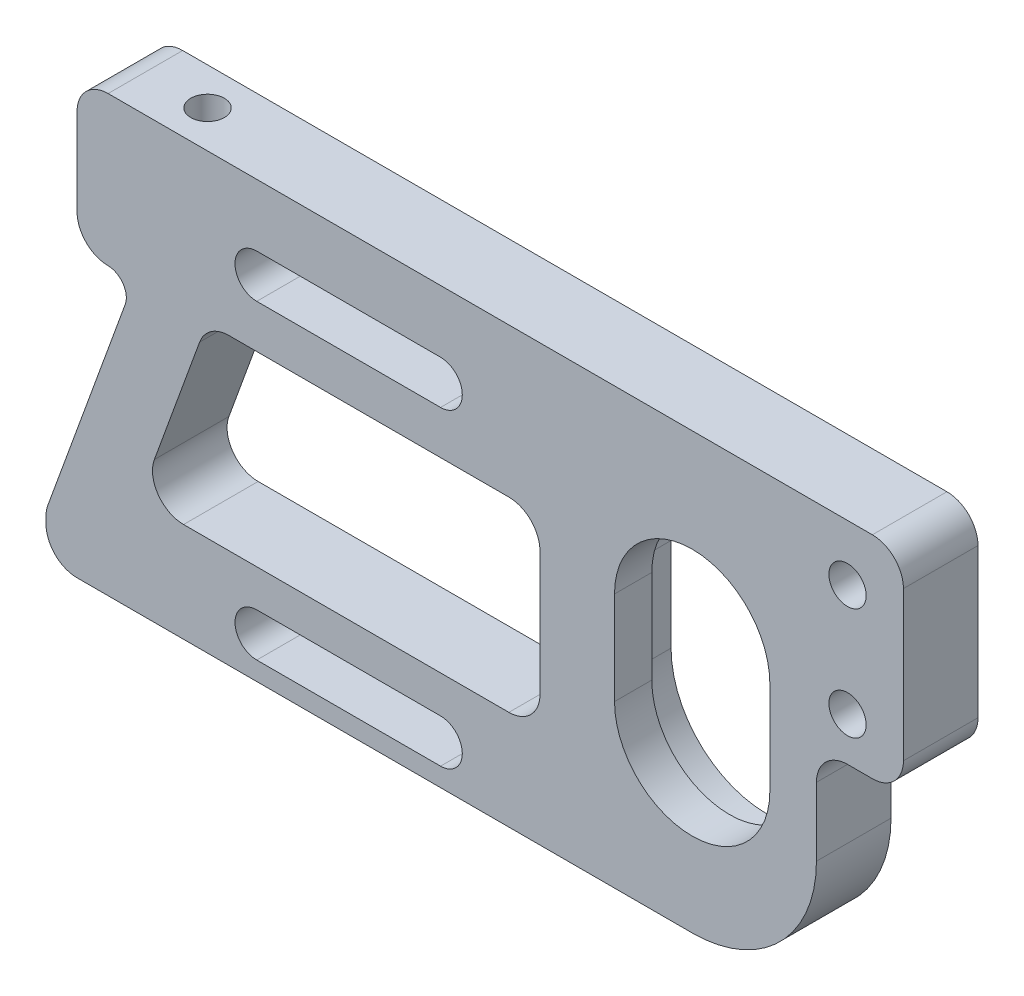
from build123d import *

# Parameters (mm, degrees)
SKETCH1_R           = 1.5
BOSS_EXTRUDE1_DEPTH = 6
SKETCH2_R           = 3.25
CUT_EXTRUDE1_DEPTH  = 3
FILLET1_R           = 2.5
FILLET2_R           = 1.5
FILLET3_R           = 10
CUT_EXTRUDE2_DEPTH  = 2
SKETCH4_R           = 1.35
CUT_EXTRUDE3_DEPTH  = 7
CUT_EXTRUDE4_START  = -10
SKETCH5_R           = 1.35
CUT_EXTRUDE4_DEPTH  = 10


with BuildPart() as part:
    # Sketch1 → Boss-Extrude1 (new body)
    with BuildSketch(Plane.XY):
        Polygon((2.5, 35), (69, 35), (69, 18), (62, 18), (62, 0), (0, 0), (0, 3.474843555), (7.106575765, 23), (2.5, 23), align=None)
        with Locations((64.5, 30.5)):
            Circle(SKETCH1_R, mode=Mode.SUBTRACT)
        with Locations((64.5, 21.5)):
            Circle(SKETCH1_R, mode=Mode.SUBTRACT)
        with BuildLine():
            Line((58.25, 20.5), (58.25, 13))
            ThreePointArc((58.25, 13), (52, 6.75), (45.75, 13))
            Line((45.75, 13), (45.75, 20.5))
            ThreePointArc((45.75, 20.5), (52, 26.75), (58.25, 20.5))
        make_face(mode=Mode.SUBTRACT)
        Polygon((7.5, 8), (39.75, 8), (39.75, 23), (12.959553514, 23), align=None, mode=Mode.SUBTRACT)
        with BuildLine():
            Line((16.959553514, 30), (31.75, 30))
            ThreePointArc((31.75, 30), (33.5, 28.25), (31.75, 26.5))
            Line((31.75, 26.5), (16.959553514, 26.5))
            ThreePointArc((16.959553514, 26.5), (15.209553514, 28.25), (16.959553514, 30))
        make_face(mode=Mode.SUBTRACT)
        with BuildLine():
            Line((16.959553514, 1.5), (31.75, 1.5))
            ThreePointArc((31.75, 1.5), (33.5, 3.25), (31.75, 5))
            Line((31.75, 5), (16.959553514, 5))
            ThreePointArc((16.959553514, 5), (15.209553514, 3.25), (16.959553514, 1.5))
        make_face(mode=Mode.SUBTRACT)
    extrude(amount=BOSS_EXTRUDE1_DEPTH)

    # Sketch2 → Cut-Extrude1 (cut)
    with BuildSketch(Plane(origin=(0, 0, 0), x_dir=(-1, 0, 0), z_dir=(0, 0, -1))):
        with Locations((-64.5, 30.5)):
            Circle(SKETCH2_R)
        with Locations((-64.5, 21.5)):
            Circle(SKETCH2_R)
        with BuildLine():
            Line((-44.3, 20.5), (-44.3, 13))
            ThreePointArc((-44.3, 13), (-52, 5.3), (-59.7, 13))
            Line((-59.7, 13), (-59.7, 20.5))
            ThreePointArc((-59.7, 20.5), (-52, 28.2), (-44.3, 20.5))
        make_face()
    extrude(amount=-CUT_EXTRUDE1_DEPTH, mode=Mode.SUBTRACT)

    # Fillet1
    fillet1_edges = [part.edges().sort_by_distance(p)[0] for p in [
        (0, 0, 3),
        (0, 3.474843555, 3),
        (2.5, 23, 3),
        (2.5, 35, 3),
        (69, 35, 3),
        (69, 18, 3),
        (62, 18, 3),
        (12.959553514, 23, 3),
        (7.5, 8, 3),
        (39.75, 8, 3),
        (39.75, 23, 3),
    ]]
    fillet(fillet1_edges, radius=FILLET1_R)

    # Fillet2
    fillet2_edges = [part.edges().sort_by_distance(p)[0] for p in [
        (7.106575765, 23, 3),
    ]]
    fillet(fillet2_edges, radius=FILLET2_R)

    # Fillet3
    fillet3_edges = [part.edges().sort_by_distance(p)[0] for p in [
        (62, 0, 3),
    ]]
    fillet(fillet3_edges, radius=FILLET3_R)

    # Sketch3 → Cut-Extrude2 (cut)
    with BuildSketch(Plane(origin=(0, 0, 0), x_dir=(-1, 0, 0), z_dir=(0, 0, -1))):
        with BuildLine():
            Line((-31.75, 31.75), (-16.959553514, 31.75))
            ThreePointArc((-16.959553514, 31.75), (-13.459553514, 28.25), (-16.959553514, 24.75))
            Line((-16.959553514, 24.75), (-31.75, 24.75))
            ThreePointArc((-31.75, 24.75), (-35.25, 28.25), (-31.75, 31.75))
        make_face()
        with BuildLine():
            Line((-31.75, 6.75), (-16.959553514, 6.75))
            ThreePointArc((-16.959553514, 6.75), (-14.48467978, 5.724873734), (-13.459553514, 3.25))
            Line((-13.459553514, 3.25), (-13.459553514, 0))
            Line((-13.459553514, 0), (-35.25, 0))
            Line((-35.25, 0), (-35.25, 3.25))
            ThreePointArc((-35.25, 3.25), (-34.224873734, 5.724873734), (-31.75, 6.75))
        make_face()
    extrude(amount=-CUT_EXTRUDE2_DEPTH, mode=Mode.SUBTRACT)

    # Sketch4 → Cut-Extrude3 (cut)
    with BuildSketch(Plane.XZ):
        with Locations(Location((10, 3, 0), (0, 0, 270))):
            Circle(SKETCH4_R)
        with Locations(Location((45, 3, 0), (0, 0, 270))):
            Circle(SKETCH4_R)
    extrude(amount=-CUT_EXTRUDE3_DEPTH, mode=Mode.SUBTRACT)

    # Sketch5 → Cut-Extrude4 (cut)
    with BuildSketch(Plane(origin=(0, 35, 0), x_dir=(1, 0, 0), z_dir=(0, 1, 0)).offset(CUT_EXTRUDE4_START)):
        with Locations(Location((10, -3, 0), (0, 0, 90))):
            Circle(SKETCH5_R)
    extrude(amount=CUT_EXTRUDE4_DEPTH, mode=Mode.SUBTRACT)


solid = part.part
